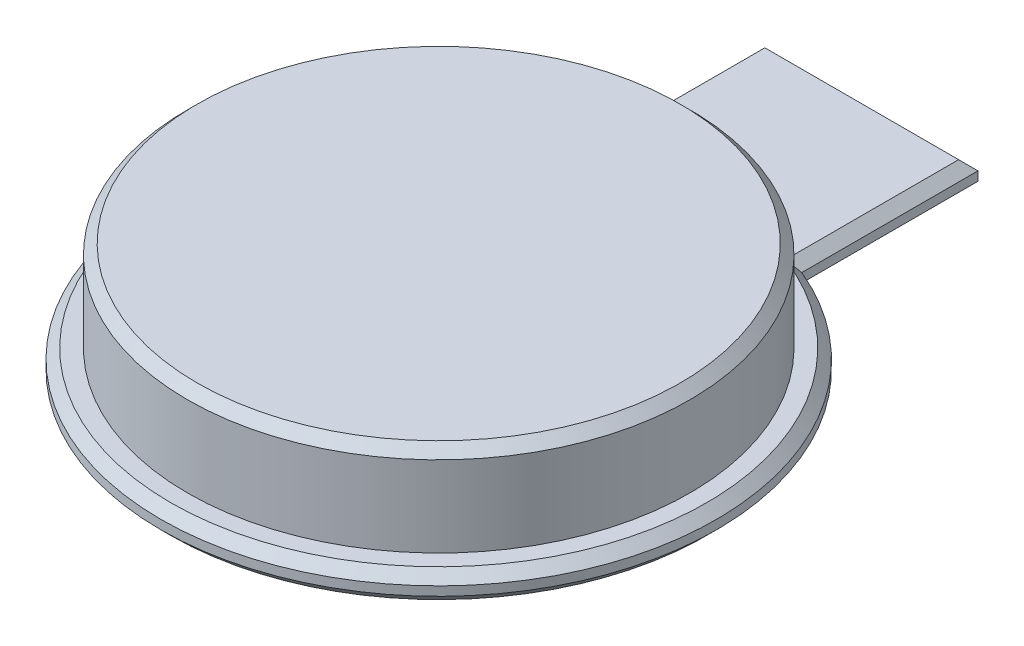
from build123d import *

# Parameters (mm, degrees)
BOSS_EXTRUDE1_DEPTH = 2.2
SKETCH2_R           = 19.45
BOSS_EXTRUDE2_DEPTH = 7
CHAMFER1_SIZE       = 0.75


with BuildPart() as part:
    # Sketch1 → Boss-Extrude1 (new body)
    with BuildSketch(Plane(origin=(0, 0, 0), x_dir=(1, 0, 0), z_dir=(0, 1, 0))):
        with BuildLine():
            Line((-8.25, 19.854155736), (-8.25, 33.5))
            Line((-8.25, 33.5), (8.25, 33.5))
            Line((8.25, 33.5), (8.25, 19.854155736))
            ThreePointArc((8.25, 19.854155736), (0, -21.5), (-8.25, 19.854155736))
        make_face()
    extrude(amount=BOSS_EXTRUDE1_DEPTH)

    # Sketch2 → Boss-Extrude2 (add)
    with BuildSketch(Plane(origin=(0, 2.2, 0), x_dir=(1, 0, 0), z_dir=(0, 1, 0))):
        with Locations(Location((0, 0, 0), (0, 0, 270))):
            Circle(SKETCH2_R)
    extrude(amount=BOSS_EXTRUDE2_DEPTH)

    # Chamfer1
    chamfer1_edges = [part.edges().sort_by_distance(p)[0] for p in [
        (0, 2.2, -33.5),
        (0, 9.2, -19.45),
        (-8.25, 2.2, -26.677077868),
        (0, 2.2, 21.5),
        (-8.25, 0, -26.677077868),
        (0, 0, -33.5),
        (8.25, 0, -26.677077868),
        (0, 0, 21.5),
        (8.25, 2.2, -26.677077868),
    ]]
    chamfer(chamfer1_edges, length=CHAMFER1_SIZE)


solid = part.part
